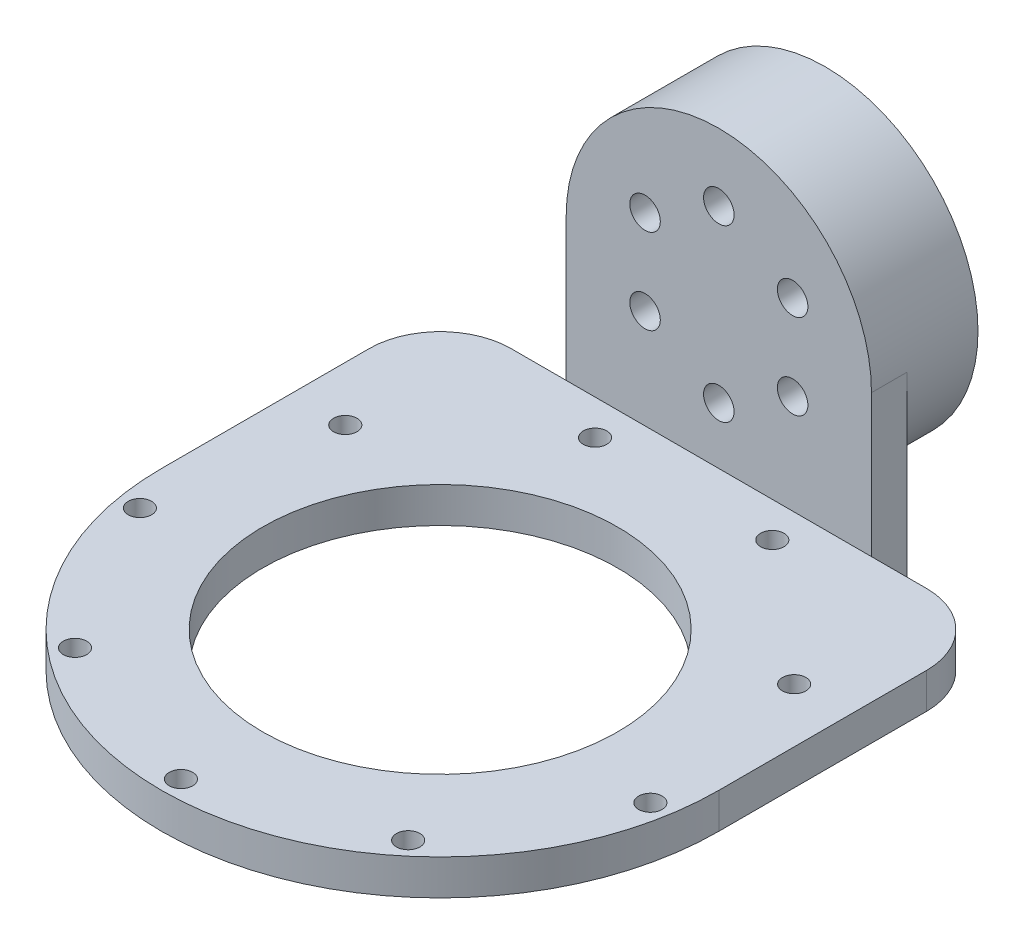
from build123d import *

# Parameters (mm, degrees)
SKETCH_1_R          = 21.5
EXTRUDE_1_DEPTH     = 10
EXTRUDE_2_DEPTH     = 5
EXTRUDE_3_DEPTH     = 5
FILLET_1_R          = 10
SKETCH_4_R          = 25
CUT_EXTRUDE_1_DEPTH = 110.56761611
SKETCH_5_R          = 1.65
CUT_EXTRUDE_2_DEPTH = 110.56761611
SKETCH_6_R          = 2.15
CUT_EXTRUDE_3_DEPTH = 92.256849058


with BuildPart() as part:
    # ｽｹｯﾁ1 → ﾎﾞｽ - 押し出し1 (new body)
    with BuildSketch(Plane.XY):
        Circle(SKETCH_1_R)
    extrude(amount=EXTRUDE_1_DEPTH)

    # ｽｹｯﾁ2 → ﾎﾞｽ - 押し出し2 (add)
    with BuildSketch(Plane.XY.offset(10)):
        with BuildLine():
            Line((-21.5, 0), (-21.5, -25))
            Line((-21.5, -25), (21.5, -25))
            Line((21.5, -25), (21.5, 0))
            ThreePointArc((21.5, 0), (0, 21.5), (-21.5, 0))
        make_face()
    extrude(amount=EXTRUDE_2_DEPTH)

    # ｽｹｯﾁ3 → ﾎﾞｽ - 押し出し3 (add)
    with BuildSketch(Plane.XZ.offset(25)):
        with BuildLine():
            Line((-39.25, 54.25), (-39.25, 15))
            Line((-39.25, 15), (39.25, 15))
            Line((39.25, 15), (39.25, 54.25))
            ThreePointArc((39.25, 54.25), (0, 93.5), (-39.25, 54.25))
        make_face()
    extrude(amount=-EXTRUDE_3_DEPTH)

    # ﾌｨﾚｯﾄ1
    fillet_1_edges = [part.edges().sort_by_distance(p)[0] for p in [
        (39.25, -22.5, 15),
        (-39.25, -22.5, 15),
    ]]
    fillet(fillet_1_edges, radius=FILLET_1_R)

    # ｽｹｯﾁ4 → ｶｯﾄ - 押し出し1 (cut, through all)
    with BuildSketch(Plane(origin=(0, -20, 0), x_dir=(1, 0, 0), z_dir=(0, 1, 0))):
        with Locations(Location((0, -54.25, 0), (0, 0, 270))):
            Circle(SKETCH_4_R)
    extrude(amount=-CUT_EXTRUDE_1_DEPTH, mode=Mode.SUBTRACT)

    # ｽｹｯﾁ5 → ｶｯﾄ - 押し出し2 (cut, through all)
    with BuildSketch(Plane(origin=(0, -20, 0), x_dir=(1, 0, 0), z_dir=(0, 1, 0))):
        with Locations(Location((0, -90.75, 0), (0, 0, 270))):
            Circle(SKETCH_5_R)
        with Locations(Location((-23.461747754, -82.210622174, 0), (0, 0, 270))):
            Circle(SKETCH_5_R)
        with Locations(Location((-35.945482985, -60.588158485, 0), (0, 0, 270))):
            Circle(SKETCH_5_R)
        with Locations(Location((-31.609927238, -36, 0), (0, 0, 270))):
            Circle(SKETCH_5_R)
        with Locations(Location((-12.483735231, -19.951219341, 0), (0, 0, 270))):
            Circle(SKETCH_5_R)
        with Locations(Location((12.483735231, -19.951219341, 0), (0, 0, 270))):
            Circle(SKETCH_5_R)
        with Locations(Location((31.609927238, -36, 0), (0, 0, 270))):
            Circle(SKETCH_5_R)
        with Locations(Location((35.945482985, -60.588158485, 0), (0, 0, 270))):
            Circle(SKETCH_5_R)
        with Locations(Location((23.461747754, -82.210622174, 0), (0, 0, 270))):
            Circle(SKETCH_5_R)
    extrude(amount=-CUT_EXTRUDE_2_DEPTH, mode=Mode.SUBTRACT)

    # ｽｹｯﾁ6 → ｶｯﾄ - 押し出し3 (cut, through all)
    with BuildSketch(Plane.XY.offset(15)):
        with Locations((0, 12)):
            Circle(SKETCH_6_R)
        with Locations((10.392304845, 6)):
            Circle(SKETCH_6_R)
        with Locations((10.392304845, -6)):
            Circle(SKETCH_6_R)
        with Locations((0, -12)):
            Circle(SKETCH_6_R)
        with Locations((-10.392304845, -6)):
            Circle(SKETCH_6_R)
        with Locations((-10.392304845, 6)):
            Circle(SKETCH_6_R)
    extrude(amount=-CUT_EXTRUDE_3_DEPTH, mode=Mode.SUBTRACT)


solid = part.part
